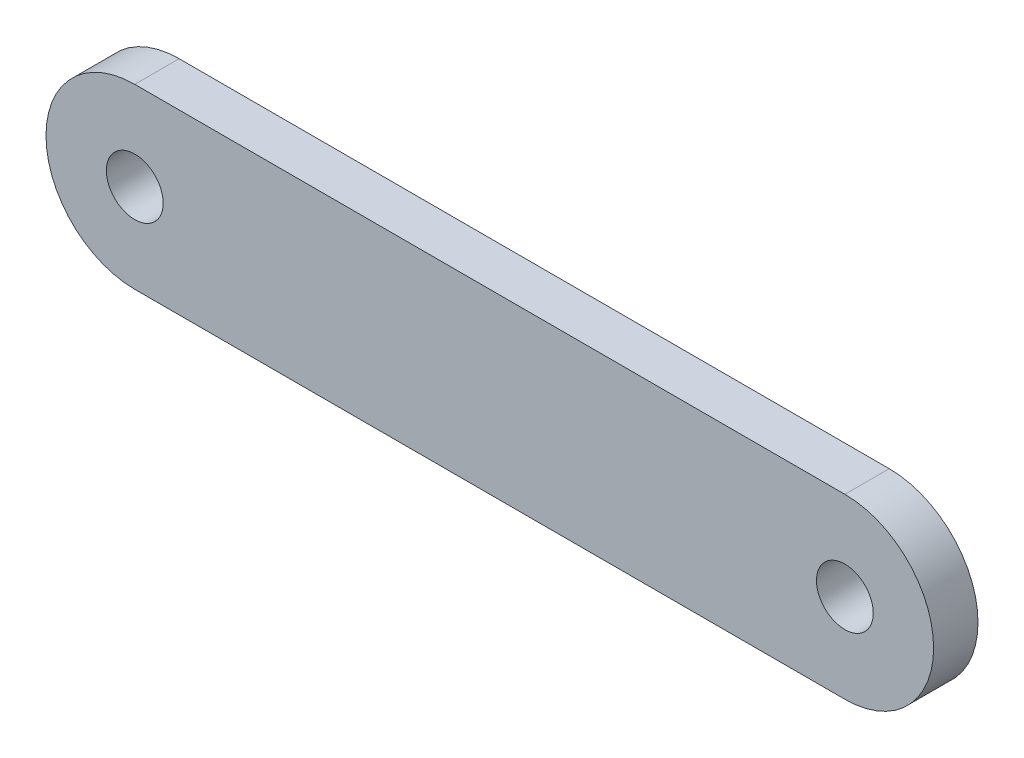
from build123d import *

# Parameters (mm, degrees)
SKETCH1_R           = 2.032
BOSS_EXTRUDE1_DEPTH = 3.175


with BuildPart() as part:
    # Sketch1 → Boss-Extrude1 (new body)
    with BuildSketch(Plane.XY):
        with BuildLine():
            Line((0, 6.35), (50.8, 6.35))
            ThreePointArc((50.8, 6.35), (57.15, 0), (50.8, -6.35))
            Line((50.8, -6.35), (0, -6.35))
            ThreePointArc((0, -6.35), (-6.35, 0), (0, 6.35))
        make_face()
        Circle(SKETCH1_R, mode=Mode.SUBTRACT)
        with Locations((50.8, 0)):
            Circle(SKETCH1_R, mode=Mode.SUBTRACT)
    extrude(amount=BOSS_EXTRUDE1_DEPTH)


solid = part.part
